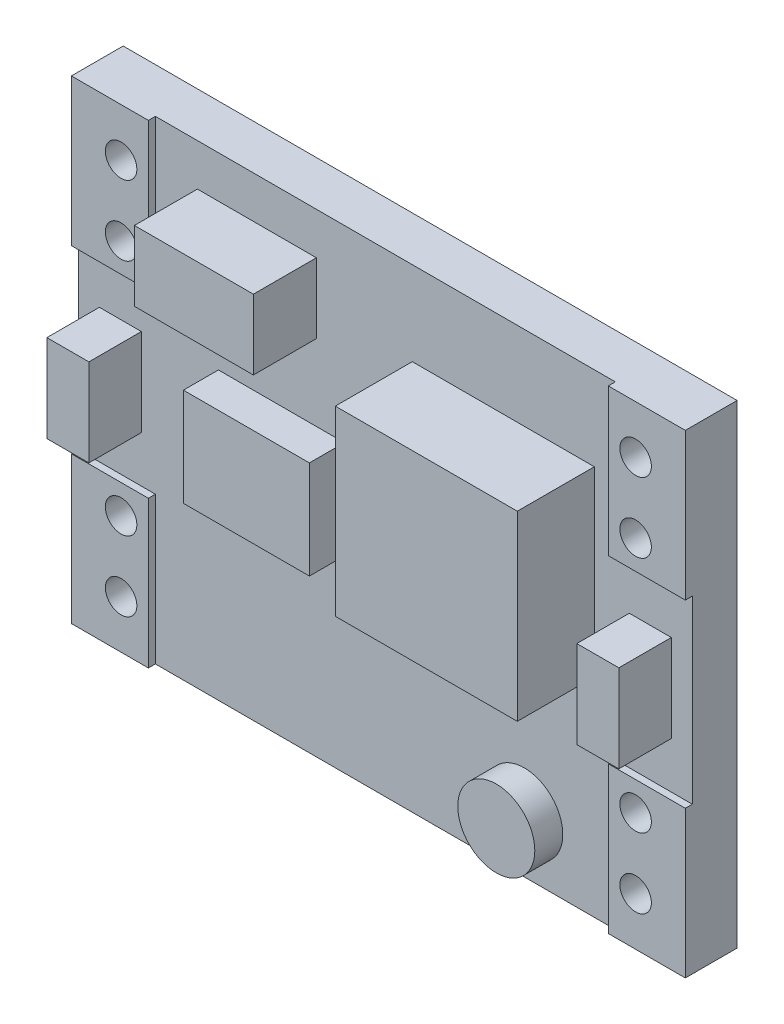
from build123d import *

# Parameters (mm, degrees)
SKETCH1_W           = 22.2758
SKETCH1_H           = 17.2085
BOSS_EXTRUDE1_DEPTH = 1.6256
SKETCH2_R           = 0.5715
CUT_EXTRUDE1_DEPTH  = 29.195501649
SKETCH3_W           = 1.524
SKETCH3_H           = 3.175
BOSS_EXTRUDE2_DEPTH = 1.905
SKETCH3_3_W         = 4.318
SKETCH3_3_H         = 2.54
BOSS_EXTRUDE3_DEPTH = 2.286
SKETCH3_4_W         = 4.572
SKETCH3_4_H         = 3.556
BOSS_EXTRUDE4_DEPTH = 1.27
SKETCH3_5_W         = 6.604
SKETCH3_5_H         = 6.604
BOSS_EXTRUDE5_DEPTH = 2.794
SKETCH3_6_R         = 1.397
BOSS_EXTRUDE6_DEPTH = 1.016
BOSS_EXTRUDE7_START = 0.254
SKETCH4_W           = 2.794
SKETCH4_H           = 5.334
SKETCH4_R           = 0.5715
BOSS_EXTRUDE7_DEPTH = 0.254


with BuildPart() as part:
    # Sketch1 → Boss-Extrude1 (new body)
    with BuildSketch(Plane.XY):
        with Locations((11.1379, 8.60425)):
            Rectangle(SKETCH1_W, SKETCH1_H)
    extrude(amount=BOSS_EXTRUDE1_DEPTH)

    # Sketch2 → Cut-Extrude1 (cut, through all)
    with BuildSketch(Plane.XY.offset(1.6256)):
        with Locations((1.8034, 15.46225)):
            Circle(SKETCH2_R)
        with Locations((1.8034, 12.92225)):
            Circle(SKETCH2_R)
        with Locations((20.4724, 15.46225)):
            Circle(SKETCH2_R)
        with Locations((20.4724, 12.92225)):
            Circle(SKETCH2_R)
        with Locations((20.4724, 4.28625)):
            Circle(SKETCH2_R)
        with Locations((20.4724, 1.74625)):
            Circle(SKETCH2_R)
        with Locations((1.8034, 4.28625)):
            Circle(SKETCH2_R)
        with Locations((1.8034, 1.74625)):
            Circle(SKETCH2_R)
    extrude(amount=-CUT_EXTRUDE1_DEPTH, mode=Mode.SUBTRACT)

    # Sketch3 → Boss-Extrude2 (add)
    with BuildSketch(Plane.XY.offset(1.6256)):
        with Locations((1.524, 8.60425)):
            Rectangle(SKETCH3_W, SKETCH3_H)
        with Locations((20.7518, 8.60425)):
            Rectangle(SKETCH3_W, SKETCH3_H)
    extrude(amount=BOSS_EXTRUDE2_DEPTH)

    # Sketch3<3> → Boss-Extrude3 (add)
    with BuildSketch(Plane.XY.offset(1.6256)):
        with Locations((6.477, 14.4145)):
            Rectangle(SKETCH3_3_W, SKETCH3_3_H)
    extrude(amount=BOSS_EXTRUDE3_DEPTH)

    # Sketch3<4> → Boss-Extrude4 (add)
    with BuildSketch(Plane.XY.offset(1.6256)):
        with Locations((7.366, 8.60425)):
            Rectangle(SKETCH3_4_W, SKETCH3_4_H)
    extrude(amount=BOSS_EXTRUDE4_DEPTH)

    # Sketch3<5> → Boss-Extrude5 (add)
    with BuildSketch(Plane.XY.offset(1.6256)):
        with Locations((15.4178, 10.8585)):
            Rectangle(SKETCH3_5_W, SKETCH3_5_H)
    extrude(amount=BOSS_EXTRUDE5_DEPTH)

    # Sketch3<6> → Boss-Extrude6 (add)
    with BuildSketch(Plane.XY.offset(1.6256)):
        with Locations((16.1798, 2.032)):
            Circle(SKETCH3_6_R)
    extrude(amount=BOSS_EXTRUDE6_DEPTH)

    # Sketch4 → Boss-Extrude7 (add)
    # profile 1 of 4: a face of its own
    with BuildSketch(Plane.XY.offset(1.6256).offset(BOSS_EXTRUDE7_START)):
        with Locations((1.397, 14.5415)):
            Rectangle(SKETCH4_W, SKETCH4_H)
        with Locations((1.8034, 12.92225)):
            Circle(SKETCH4_R, mode=Mode.SUBTRACT)
        with Locations((1.8034, 15.46225)):
            Circle(SKETCH4_R, mode=Mode.SUBTRACT)
    # profile 2 of 4: a face of its own
    with BuildSketch(Plane.XY.offset(1.6256).offset(BOSS_EXTRUDE7_START)):
        with Locations((1.397, 2.667)):
            Rectangle(SKETCH4_W, SKETCH4_H)
        with Locations((1.8034, 1.74625)):
            Circle(SKETCH4_R, mode=Mode.SUBTRACT)
        with Locations((1.8034, 4.28625)):
            Circle(SKETCH4_R, mode=Mode.SUBTRACT)
    # profile 3 of 4: a face of its own
    with BuildSketch(Plane.XY.offset(1.6256).offset(BOSS_EXTRUDE7_START)):
        with Locations((20.8788, 2.667)):
            Rectangle(SKETCH4_W, SKETCH4_H)
        with Locations((20.4724, 4.28625)):
            Circle(SKETCH4_R, mode=Mode.SUBTRACT)
        with Locations((20.4724, 1.74625)):
            Circle(SKETCH4_R, mode=Mode.SUBTRACT)
    # profile 4 of 4: a face of its own
    with BuildSketch(Plane.XY.offset(1.6256).offset(BOSS_EXTRUDE7_START)):
        with Locations((20.8788, 14.5415)):
            Rectangle(SKETCH4_W, SKETCH4_H)
        with Locations((20.4724, 15.46225)):
            Circle(SKETCH4_R, mode=Mode.SUBTRACT)
        with Locations((20.4724, 12.92225)):
            Circle(SKETCH4_R, mode=Mode.SUBTRACT)
    extrude(amount=-BOSS_EXTRUDE7_DEPTH)


solid = part.part
